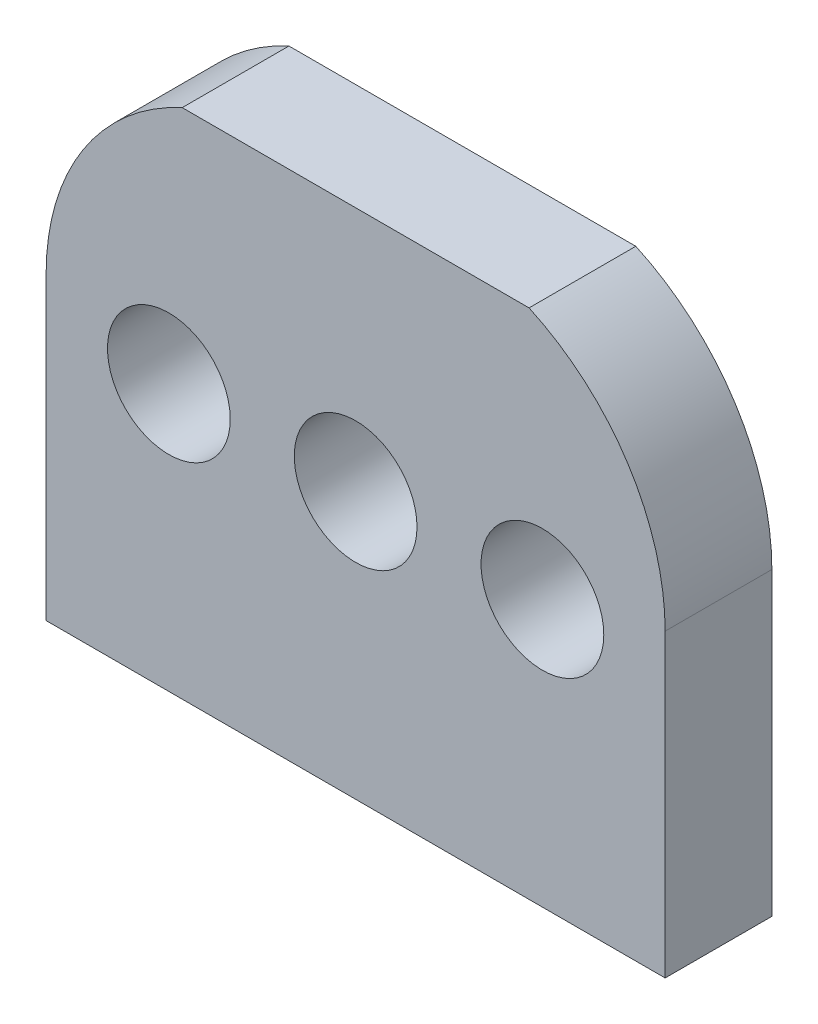
from build123d import *

# Parameters (mm, degrees)
SZKIC1_R                    = 1.15
DODANIE_WYCI_GNI_CIE1_DEPTH = 2


with BuildPart() as part:
    # Szkic1 → Dodanie-wyciągnięcie1 (new body)
    with BuildSketch(Plane.XY):
        with BuildLine():
            Line((-5.8, -4.994143627), (5.8, -4.994143627))
            Line((5.8, -4.994143627), (5.8, 0.63488027))
            ThreePointArc((5.8, 0.63488027), (5.10760912, 2.994496299), (3.25, 4.605856373))
            Line((3.25, 4.605856373), (-3.25, 4.605856373))
            ThreePointArc((-3.25, 4.605856373), (-5.10760912, 2.994496299), (-5.8, 0.63488027))
            Line((-5.8, 0.63488027), (-5.8, -4.994143627))
        make_face()
        Circle(SZKIC1_R, mode=Mode.SUBTRACT)
        with Locations((3.5, 0)):
            Circle(SZKIC1_R, mode=Mode.SUBTRACT)
        with Locations((-3.5, 0)):
            Circle(SZKIC1_R, mode=Mode.SUBTRACT)
    extrude(amount=DODANIE_WYCI_GNI_CIE1_DEPTH)


solid = part.part
